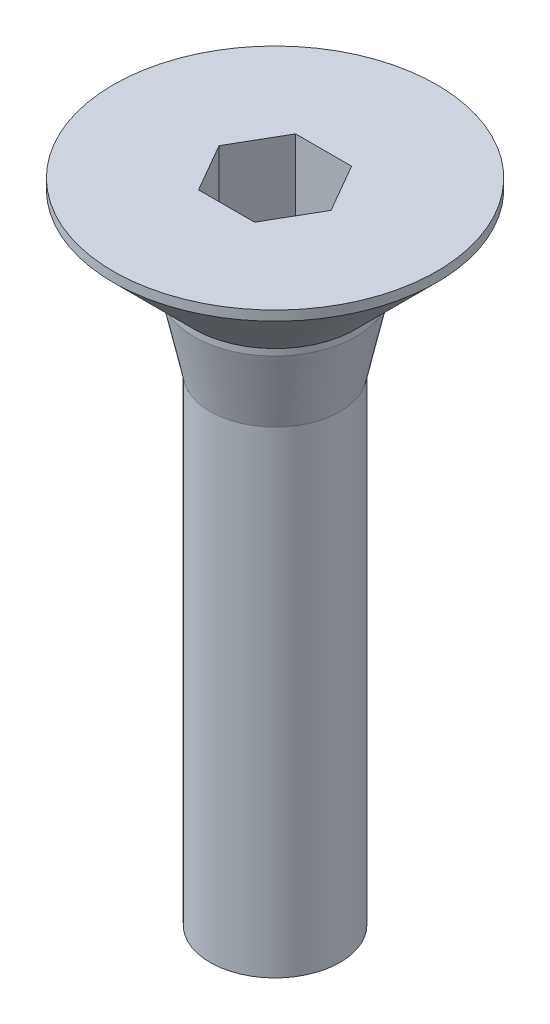
from build123d import *

# Parameters (mm, degrees)
SCHNITT_LINEAR_AUSTRAGEN1_DEPTH = 5.3


with BuildPart() as part:
    # Skizze1 → Basis-Rotation (revolve)
    with BuildSketch(Plane.XY, mode=Mode.PRIVATE) as basis_rotation_sk:
        Polygon((0, 0), (5, 0), (5, -0.3), (2.5, -2.8), (2.5, -3), (2.0095, -5.25), (2.0095, -20), (0, -20), align=None)
    revolve(basis_rotation_sk.sketch.rotate(Axis((0, 0, 0), (0, -1, 0)), 180), axis=Axis((0, 0, 0), (0, -1, 0)))

    # Skizze2 → Schnitt-Linear austragen1 (cut)
    with BuildSketch(Plane(origin=(0, 0, 0), x_dir=(-1, 0, 0), z_dir=(0, 1, 0))):
        Polygon((0.866025404, -1.5), (-0.866025404, -1.5), (-1.732050808, 0), (-0.866025404, 1.5), (0.866025404, 1.5), (1.732050808, 0), align=None)
    extrude(amount=-SCHNITT_LINEAR_AUSTRAGEN1_DEPTH, mode=Mode.SUBTRACT)


solid = part.part
